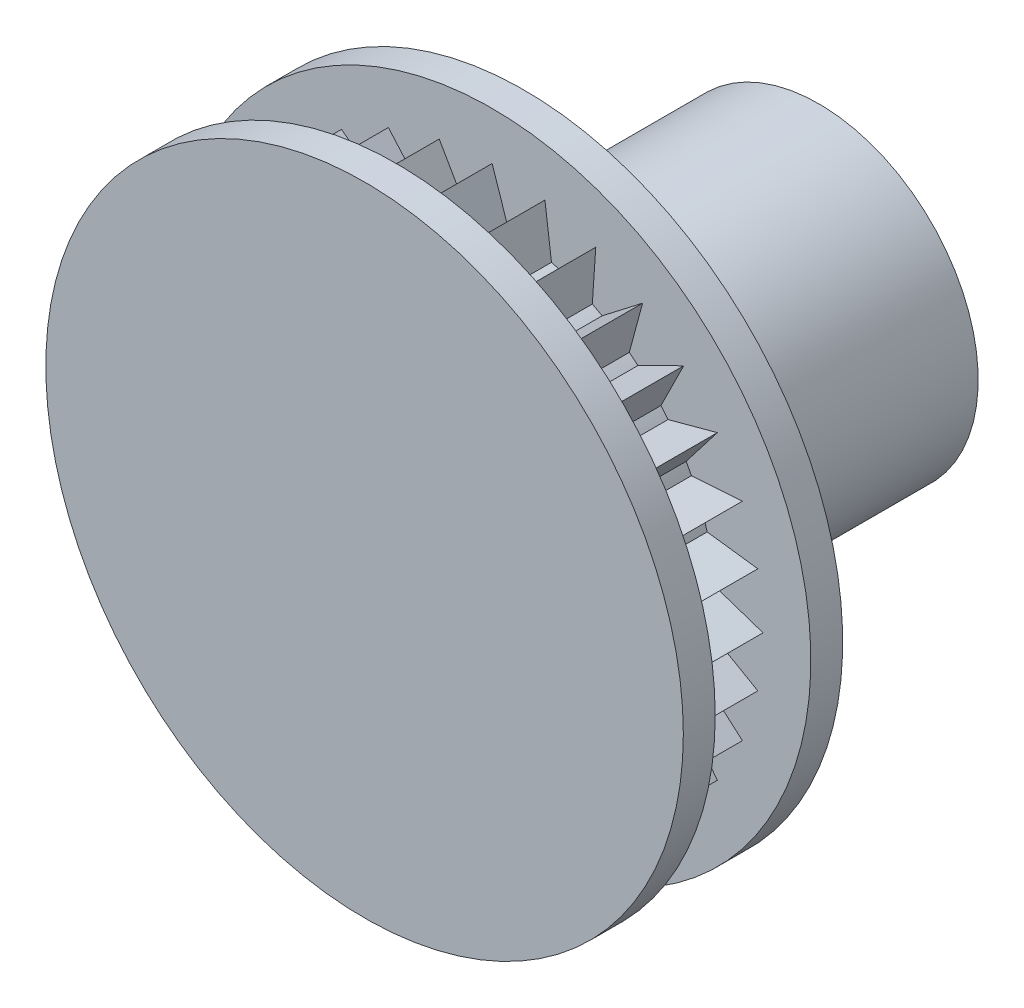
from build123d import *

# Parameters (mm, degrees)
SKETCH1_R           = 10
BOSS_EXTRUDE1_DEPTH = 10
SKETCH2_R           = 20
BOSS_EXTRUDE2_DEPTH = 2
BOSS_EXTRUDE3_START = -2
SKETCH3_R           = 20
BOSS_EXTRUDE3_DEPTH = 2
BOSS_EXTRUDE4_START = 18.5
SKETCH4_R           = 10
SKETCH4_R_2         = 0.05
BOSS_EXTRUDE4_DEPTH = 18.5
SKETCH5_R           = 11
BOSS_EXTRUDE5_DEPTH = 3.5


with BuildPart() as part:
    # Sketch1 → Boss-Extrude1 (new body)
    with BuildSketch(Plane.XY):
        with BuildLine():
            Line((0, 17), (1.023829773, 13.962513119))
            ThreePointArc((1.023829773, 13.962513119), (1.372239965, 13.932586173), (1.719794009, 13.893966625))
            Line((1.719794009, 13.893966625), (3.316535474, 16.673349767))
            Line((3.316535474, 16.673349767), (3.728108352, 13.494488064))
            ThreePointArc((3.728108352, 13.494488064), (4.063985482, 13.3971647), (4.397327072, 13.291482785))
            Line((4.397327072, 13.291482785), (6.50561835, 15.705952053))
            Line((6.50561835, 15.705952053), (6.289117817, 12.507877401))
            ThreePointArc((6.289117817, 12.507877401), (6.599554316, 12.346897701), (6.905873322, 12.178214715))
            Line((6.905873322, 12.178214715), (9.444693961, 14.134983409))
            Line((9.444693961, 14.134983409), (8.608440012, 11.040596024))
            ThreePointArc((8.608440012, 11.040596024), (8.881505978, 10.822146347), (9.149030733, 10.596944684))
            Line((9.149030733, 10.596944684), (12.02081528, 12.02081528))
            Line((12.02081528, 12.02081528), (10.596944684, 9.149030733))
            ThreePointArc((10.596944684, 9.149030733), (10.822146347, 8.881505978), (11.040596024, 8.608440012))
            Line((11.040596024, 8.608440012), (14.134983409, 9.444693961))
            Line((14.134983409, 9.444693961), (12.178214715, 6.905873322))
            ThreePointArc((12.178214715, 6.905873322), (12.346897701, 6.599554316), (12.507877401, 6.289117817))
            Line((12.507877401, 6.289117817), (15.705952053, 6.50561835))
            Line((15.705952053, 6.50561835), (13.291482785, 4.397327072))
            ThreePointArc((13.291482785, 4.397327072), (13.3971647, 4.063985482), (13.494488064, 3.728108352))
            Line((13.494488064, 3.728108352), (16.673349767, 3.316535474))
            Line((16.673349767, 3.316535474), (13.893966625, 1.719794009))
            ThreePointArc((13.893966625, 1.719794009), (13.932586173, 1.372239965), (13.962513119, 1.023829773))
            Line((13.962513119, 1.023829773), (17, 0))
            Line((17, 0), (13.962513119, -1.023829773))
            ThreePointArc((13.962513119, -1.023829773), (13.932586173, -1.372239965), (13.893966625, -1.719794009))
            Line((13.893966625, -1.719794009), (16.673349767, -3.316535474))
            Line((16.673349767, -3.316535474), (13.494488064, -3.728108352))
            ThreePointArc((13.494488064, -3.728108352), (13.3971647, -4.063985482), (13.291482785, -4.397327072))
            Line((13.291482785, -4.397327072), (15.705952053, -6.50561835))
            Line((15.705952053, -6.50561835), (12.507877401, -6.289117817))
            ThreePointArc((12.507877401, -6.289117817), (12.346897701, -6.599554316), (12.178214715, -6.905873322))
            Line((12.178214715, -6.905873322), (14.134983409, -9.444693961))
            Line((14.134983409, -9.444693961), (11.040596024, -8.608440012))
            ThreePointArc((11.040596024, -8.608440012), (10.822146347, -8.881505978), (10.596944684, -9.149030733))
            Line((10.596944684, -9.149030733), (12.02081528, -12.02081528))
            Line((12.02081528, -12.02081528), (9.149030733, -10.596944684))
            ThreePointArc((9.149030733, -10.596944684), (8.881505978, -10.822146347), (8.608440012, -11.040596024))
            Line((8.608440012, -11.040596024), (9.444693961, -14.134983409))
            Line((9.444693961, -14.134983409), (6.905873322, -12.178214715))
            ThreePointArc((6.905873322, -12.178214715), (6.599554316, -12.346897701), (6.289117817, -12.507877401))
            Line((6.289117817, -12.507877401), (6.50561835, -15.705952053))
            Line((6.50561835, -15.705952053), (4.397327072, -13.291482785))
            ThreePointArc((4.397327072, -13.291482785), (4.063985482, -13.3971647), (3.728108352, -13.494488064))
            Line((3.728108352, -13.494488064), (3.316535474, -16.673349767))
            Line((3.316535474, -16.673349767), (1.719794009, -13.893966625))
            ThreePointArc((1.719794009, -13.893966625), (1.372239965, -13.932586173), (1.023829773, -13.962513119))
            Line((1.023829773, -13.962513119), (0, -17))
            Line((0, -17), (-1.023829773, -13.962513119))
            ThreePointArc((-1.023829773, -13.962513119), (-1.372239965, -13.932586173), (-1.719794009, -13.893966625))
            Line((-1.719794009, -13.893966625), (-3.316535474, -16.673349767))
            Line((-3.316535474, -16.673349767), (-3.728108352, -13.494488064))
            ThreePointArc((-3.728108352, -13.494488064), (-4.063985482, -13.3971647), (-4.397327072, -13.291482785))
            Line((-4.397327072, -13.291482785), (-6.50561835, -15.705952053))
            Line((-6.50561835, -15.705952053), (-6.289117817, -12.507877401))
            ThreePointArc((-6.289117817, -12.507877401), (-6.599554316, -12.346897701), (-6.905873322, -12.178214715))
            Line((-6.905873322, -12.178214715), (-9.444693961, -14.134983409))
            Line((-9.444693961, -14.134983409), (-8.608440012, -11.040596024))
            ThreePointArc((-8.608440012, -11.040596024), (-8.881505978, -10.822146347), (-9.149030733, -10.596944684))
            Line((-9.149030733, -10.596944684), (-12.02081528, -12.02081528))
            Line((-12.02081528, -12.02081528), (-10.596944684, -9.149030733))
            ThreePointArc((-10.596944684, -9.149030733), (-10.822146347, -8.881505978), (-11.040596024, -8.608440012))
            Line((-11.040596024, -8.608440012), (-14.134983409, -9.444693961))
            Line((-14.134983409, -9.444693961), (-12.178214715, -6.905873322))
            ThreePointArc((-12.178214715, -6.905873322), (-12.346897701, -6.599554316), (-12.507877401, -6.289117817))
            Line((-12.507877401, -6.289117817), (-15.705952053, -6.50561835))
            Line((-15.705952053, -6.50561835), (-13.291482785, -4.397327072))
            ThreePointArc((-13.291482785, -4.397327072), (-13.3971647, -4.063985482), (-13.494488064, -3.728108352))
            Line((-13.494488064, -3.728108352), (-16.673349767, -3.316535474))
            Line((-16.673349767, -3.316535474), (-13.893966625, -1.719794009))
            ThreePointArc((-13.893966625, -1.719794009), (-13.932586173, -1.372239965), (-13.962513119, -1.023829773))
            Line((-13.962513119, -1.023829773), (-17, 0))
            Line((-17, 0), (-13.962513119, 1.023829773))
            ThreePointArc((-13.962513119, 1.023829773), (-13.932586173, 1.372239965), (-13.893966625, 1.719794009))
            Line((-13.893966625, 1.719794009), (-16.673349767, 3.316535474))
            Line((-16.673349767, 3.316535474), (-13.494488064, 3.728108352))
            ThreePointArc((-13.494488064, 3.728108352), (-13.3971647, 4.063985482), (-13.291482785, 4.397327072))
            Line((-13.291482785, 4.397327072), (-15.705952053, 6.50561835))
            Line((-15.705952053, 6.50561835), (-12.507877401, 6.289117817))
            ThreePointArc((-12.507877401, 6.289117817), (-12.346897701, 6.599554316), (-12.178214715, 6.905873322))
            Line((-12.178214715, 6.905873322), (-14.134983409, 9.444693961))
            Line((-14.134983409, 9.444693961), (-11.040596024, 8.608440012))
            ThreePointArc((-11.040596024, 8.608440012), (-10.822146347, 8.881505978), (-10.596944684, 9.149030733))
            Line((-10.596944684, 9.149030733), (-12.02081528, 12.02081528))
            Line((-12.02081528, 12.02081528), (-9.149030733, 10.596944684))
            ThreePointArc((-9.149030733, 10.596944684), (-8.881505978, 10.822146347), (-8.608440012, 11.040596024))
            Line((-8.608440012, 11.040596024), (-9.444693961, 14.134983409))
            Line((-9.444693961, 14.134983409), (-6.905873322, 12.178214715))
            ThreePointArc((-6.905873322, 12.178214715), (-6.599554316, 12.346897701), (-6.289117817, 12.507877401))
            Line((-6.289117817, 12.507877401), (-6.50561835, 15.705952053))
            Line((-6.50561835, 15.705952053), (-4.397327072, 13.291482785))
            ThreePointArc((-4.397327072, 13.291482785), (-4.063985482, 13.3971647), (-3.728108352, 13.494488064))
            Line((-3.728108352, 13.494488064), (-3.316535474, 16.673349767))
            Line((-3.316535474, 16.673349767), (-1.719794009, 13.893966625))
            ThreePointArc((-1.719794009, 13.893966625), (-1.372239965, 13.932586173), (-1.023829773, 13.962513119))
            Line((-1.023829773, 13.962513119), (0, 17))
        make_face()
        Circle(SKETCH1_R, mode=Mode.SUBTRACT)
    extrude(amount=BOSS_EXTRUDE1_DEPTH)

    # Sketch2 → Boss-Extrude2 (add)
    with BuildSketch(Plane.XY.offset(10)):
        Circle(SKETCH2_R)
    extrude(amount=-BOSS_EXTRUDE2_DEPTH)

    # Sketch3 → Boss-Extrude3 (add)
    with BuildSketch(Plane(origin=(0, 0, 0), x_dir=(-1, 0, 0), z_dir=(0, 0, -1)).offset(BOSS_EXTRUDE3_START)):
        with Locations(Location((0, 0, 0), (0, 0, 180))):
            Circle(SKETCH3_R)
    extrude(amount=BOSS_EXTRUDE3_DEPTH)

    # Sketch4 → Boss-Extrude4 (add)
    with BuildSketch(Plane(origin=(0, 0, 0), x_dir=(-1, 0, 0), z_dir=(0, 0, -1)).offset(BOSS_EXTRUDE4_START)):
        Circle(SKETCH4_R)
        Circle(SKETCH4_R_2, mode=Mode.SUBTRACT)
    extrude(amount=-BOSS_EXTRUDE4_DEPTH)

    # Sketch5 → Boss-Extrude5 (add)
    with BuildSketch(Plane(origin=(0, 0, 0), x_dir=(-1, 0, 0), z_dir=(0, 0, -1))):
        with Locations(Location((0, 0, 0), (0, 0, 180))):
            Circle(SKETCH5_R)
    extrude(amount=BOSS_EXTRUDE5_DEPTH)


solid = part.part
